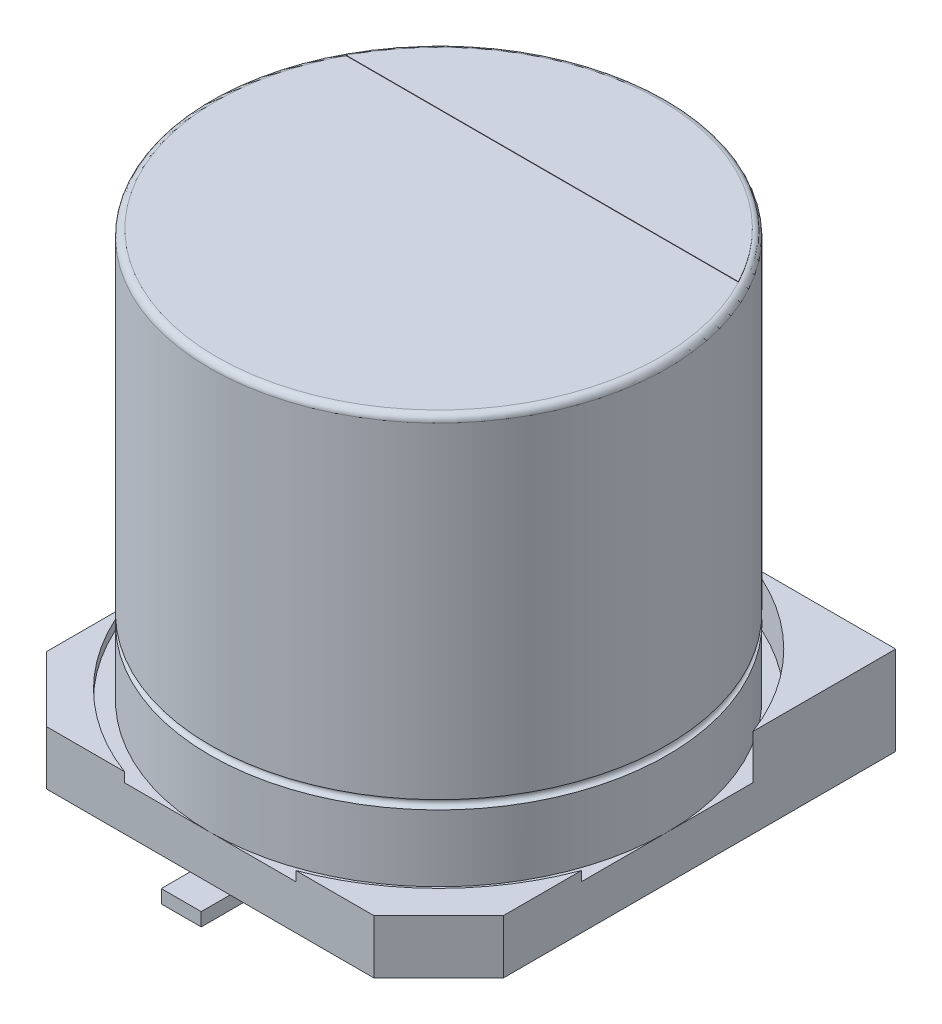
from build123d import *

# Parameters (mm, degrees)
BOSS_EXTRUDE1_DEPTH = 2
SKETCH2_R           = 5.5
CUT_EXTRUDE1_DEPTH  = 1
CUT_EXTRUDE4_START  = -10.3
SKETCH8_W           = 4.983499023
SKETCH8_H           = 1.601104922
CUT_EXTRUDE4_DEPTH  = 10.3
BOSS_EXTRUDE4_DEPTH = 0.01
SKETCH9_W           = 0.9
SKETCH9_H           = 3.5
BOSS_EXTRUDE5_DEPTH = 0.3


with BuildPart() as part:
    # Sketch1 → Boss-Extrude1 (new body)
    with BuildSketch(Plane(origin=(0, 0, 0), x_dir=(1, 0, 0), z_dir=(0, 1, 0))):
        Polygon((-5.15, 5.15), (5.15, 5.15), (5.15, -3.691193695), (3.691193695, -5.15), (-3.691193695, -5.15), (-5.15, -3.691193695), align=None)
    extrude(amount=BOSS_EXTRUDE1_DEPTH)

    # Sketch2 → Cut-Extrude1 (cut)
    with BuildSketch(Plane(origin=(0, 2, 0), x_dir=(1, 0, 0), z_dir=(0, 1, 0))):
        Circle(SKETCH2_R)
    extrude(amount=-CUT_EXTRUDE1_DEPTH, mode=Mode.SUBTRACT)

    # Sketch8 → Cut-Extrude4 (cut)
    with BuildSketch(Plane.ZY.offset(5.15).offset(CUT_EXTRUDE4_START)):
        with Locations((3.408264651, 2.017914887)):
            Rectangle(SKETCH8_W, SKETCH8_H)
    extrude(amount=CUT_EXTRUDE4_DEPTH, mode=Mode.SUBTRACT)

    # Sketch5 → Revolve1 (revolve)
    with BuildSketch(Plane.XY, mode=Mode.PRIVATE) as revolve1_sk:
        with BuildLine():
            Line((0, 1), (-5.15, 1))
            Line((-5.15, 1), (-5.15, 2.5))
            ThreePointArc((-5.15, 2.5), (-5.05, 2.6), (-5.15, 2.7))
            Line((-5.15, 2.7), (-5.15, 10.05))
            ThreePointArc((-5.15, 10.05), (-5.106066017, 10.156066017), (-5, 10.2))
            Line((-5, 10.2), (0, 10.2))
            Line((0, 10.2), (0, 1))
        make_face()
    revolve(revolve1_sk.sketch.rotate(Axis((0, 10.2, 0), (0, -1, 0)), 270), axis=Axis((0, 10.2, 0), (0, -1, 0)))

    # Sketch6 → Boss-Extrude4 (add)
    with BuildSketch(Plane(origin=(0, 10.2, 0), x_dir=(1, 0, 0), z_dir=(0, 1, 0))):
        with BuildLine():
            Line((-4.420287671, 2.336890435), (4.420287671, 2.336890435))
            ThreePointArc((4.420287671, 2.336890435), (0, 5), (-4.420287671, 2.336890435))
        make_face()
    extrude(amount=BOSS_EXTRUDE4_DEPTH)

    # Sketch9 → Boss-Extrude5 (add)
    with BuildSketch(Plane.XZ):
        with Locations((0, -4.05)):
            Rectangle(SKETCH9_W, SKETCH9_H)
        with Locations((0, 4.05)):
            Rectangle(SKETCH9_W, SKETCH9_H)
    extrude(amount=BOSS_EXTRUDE5_DEPTH)


solid = part.part
